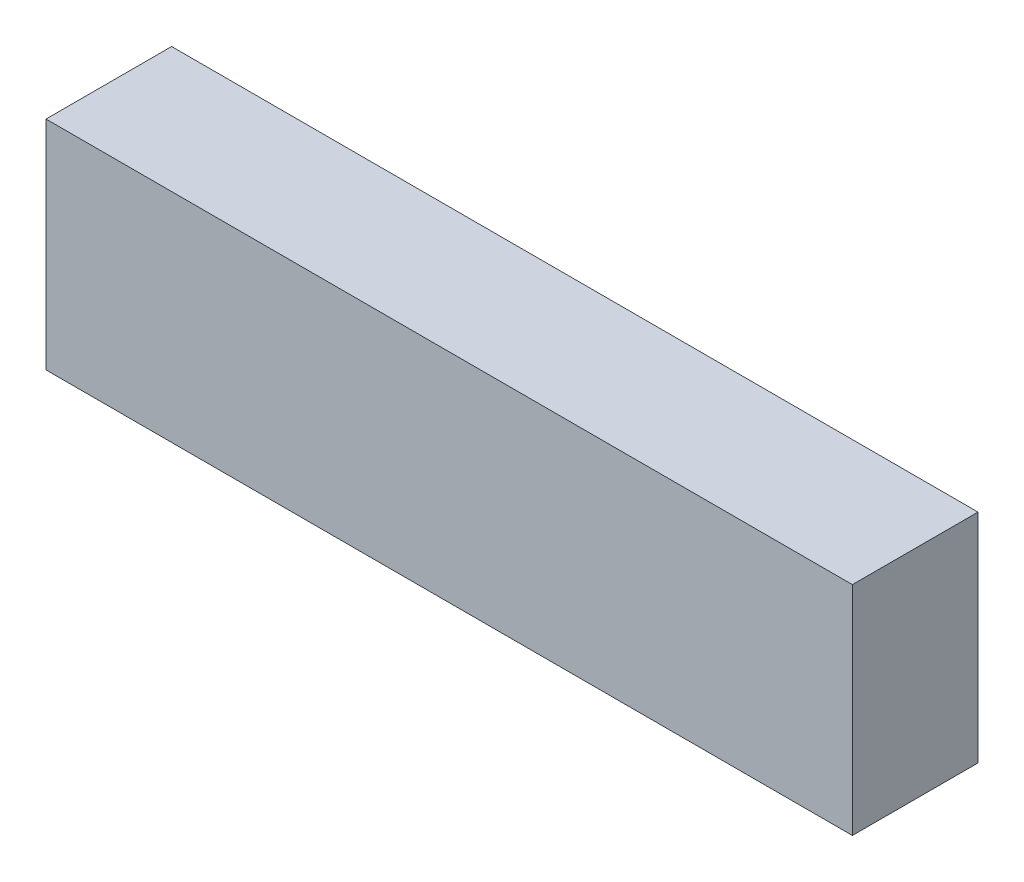
from build123d import *

# Parameters (mm, degrees)
SKETCH1_W                 = 46.54130149
SKETCH1_H                 = 12.54
BOSS_EXTRUDE1_DEPTH       = 7.25
SHELL1_T                  = -0.5
SHELL1_THICKNESS_2_FACE_W = 45.54130149
SHELL1_THICKNESS_2_FACE_H = 11.54
SHELL1_THICKNESS_2_DEPTH  = 0.3


with BuildPart() as part:
    # Sketch1 → Boss-Extrude1 (new body)
    with BuildSketch(Plane.XY):
        with Locations((-55.766150745, 39.86)):
            Rectangle(SKETCH1_W, SKETCH1_H)
    extrude(amount=BOSS_EXTRUDE1_DEPTH)

    # Shell1
    shell1_openings = [part.faces().sort_by_distance(p)[0] for p in [
        (-55.766150745, 39.86, 0),
    ]]
    offset(amount=SHELL1_T, openings=shell1_openings, kind=Kind.INTERSECTION)

    # Shell1 thickness 2 face (on inner face of the shell) → Shell1 thickness 2 (cut)
    with BuildSketch(Plane(origin=(-55.766150745, 39.86, 6.75), x_dir=(1, 0, 0), z_dir=(0, 0, 1))):
        Rectangle(SHELL1_THICKNESS_2_FACE_W, SHELL1_THICKNESS_2_FACE_H)
    extrude(amount=SHELL1_THICKNESS_2_DEPTH, mode=Mode.SUBTRACT)


solid = part.part
